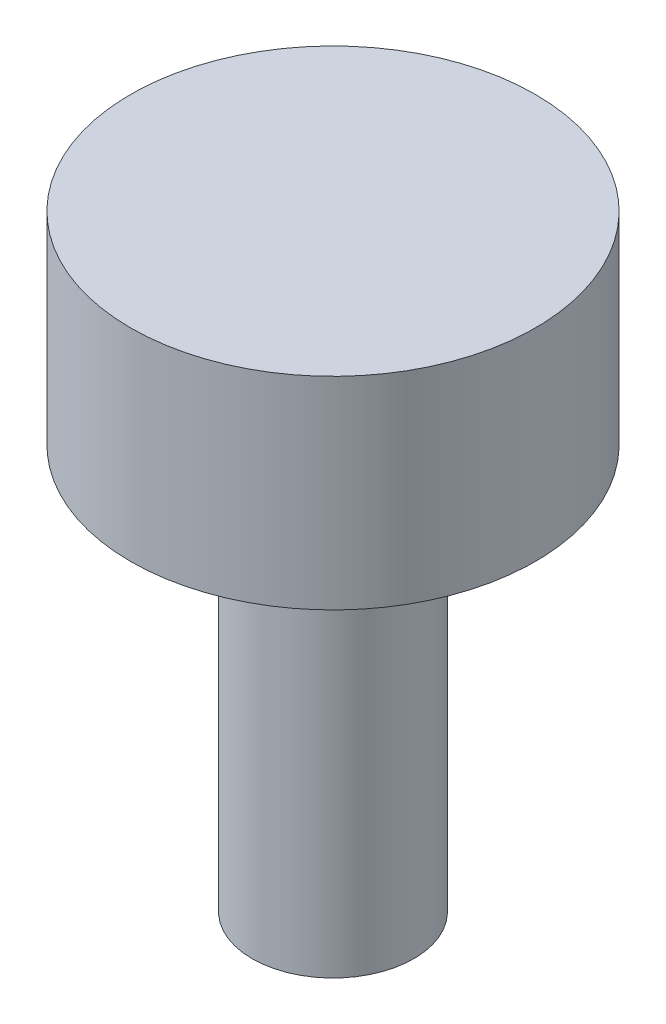
from build123d import *

# Parameters (mm, degrees)
SKETCH1_R           = 1
BOSS_EXTRUDE1_DEPTH = 5
SKETCH2_R           = 2.5
BOSS_EXTRUDE2_DEPTH = 2.5


with BuildPart() as part:
    # Sketch1 → Boss-Extrude1 (new body)
    with BuildSketch(Plane(origin=(0, 0, 0), x_dir=(1, 0, 0), z_dir=(0, 1, 0))):
        with Locations(Location((0, 0, 0), (0, 0, 270))):
            Circle(SKETCH1_R)
    extrude(amount=BOSS_EXTRUDE1_DEPTH)

    # Sketch2 → Boss-Extrude2 (add)
    with BuildSketch(Plane(origin=(0, 5, 0), x_dir=(1, 0, 0), z_dir=(0, 1, 0))):
        with Locations(Location((0, 0, 0), (0, 0, 270))):
            Circle(SKETCH2_R)
    extrude(amount=BOSS_EXTRUDE2_DEPTH)


solid = part.part
